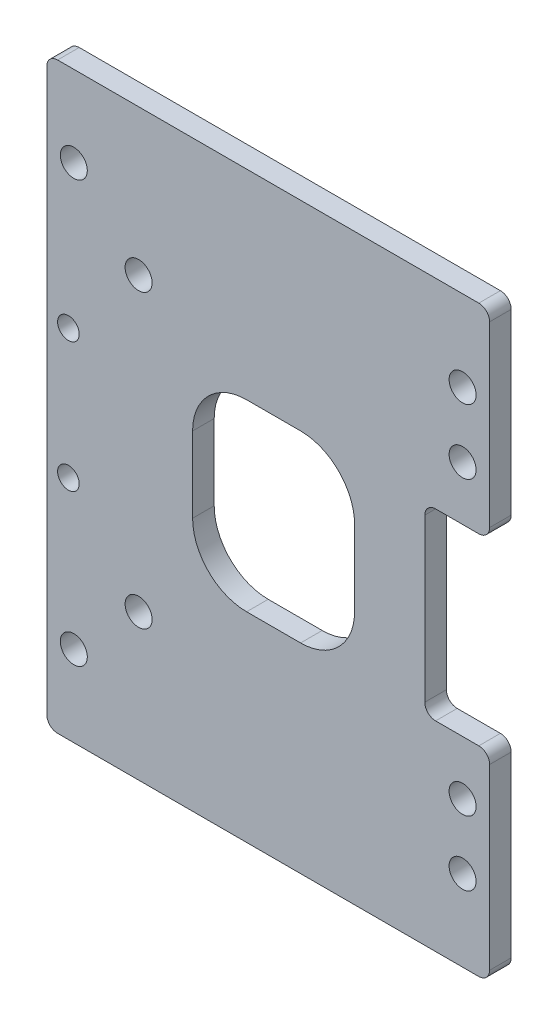
from build123d import *

# Parameters (mm, degrees)
SKETCH_1_R      = 1.25
SKETCH_1_R_2    = 1
EXTRUDE_1_DEPTH = 2


with BuildPart() as part:
    # 草圖1 → 填料-伸長1 (new body)
    with BuildSketch(Plane.XY):
        with BuildLine():
            Line((25.714690816, 4.04468624), (25.714690816, -0.95531376))
            Line((25.714690816, -0.95531376), (25.714690816, -12.45531376))
            ThreePointArc((25.714690816, -12.45531376), (25.421797597, -13.162420542), (24.714690816, -13.45531376))
            Line((24.714690816, -13.45531376), (-14.285309184, -13.45531376))
            ThreePointArc((-14.285309184, -13.45531376), (-14.992415965, -13.162420542), (-15.285309184, -12.45531376))
            Line((-15.285309184, -12.45531376), (-15.285309184, 3.54468624))
            Line((-15.285309184, 3.54468624), (-15.285309184, 23.54468624))
            Line((-15.285309184, 23.54468624), (-15.285309184, 39.54468624))
            ThreePointArc((-15.285309184, 39.54468624), (-14.992415965, 40.251793021), (-14.285309184, 40.54468624))
            Line((-14.285309184, 40.54468624), (24.714690816, 40.54468624))
            ThreePointArc((24.714690816, 40.54468624), (25.421797597, 40.251793021), (25.714690816, 39.54468624))
            Line((25.714690816, 39.54468624), (25.714690816, 28.54468624))
            Line((25.714690816, 28.54468624), (25.714690816, 23.04468624))
            ThreePointArc((25.714690816, 23.04468624), (25.421797597, 22.337579458), (24.714690816, 22.04468624))
            Line((24.714690816, 22.04468624), (20.714690816, 22.04468624))
            ThreePointArc((20.714690816, 22.04468624), (20.007584035, 21.751793021), (19.714690816, 21.04468624))
            Line((19.714690816, 21.04468624), (19.714690816, 6.04468624))
            ThreePointArc((19.714690816, 6.04468624), (20.007584035, 5.337579458), (20.714690816, 5.04468624))
            Line((20.714690816, 5.04468624), (24.714690816, 5.04468624))
            ThreePointArc((24.714690816, 5.04468624), (25.421797597, 4.751793021), (25.714690816, 4.04468624))
        make_face()
        with Locations((-6.785309184, 27.04468624)):
            Circle(SKETCH_1_R, mode=Mode.SUBTRACT)
        with Locations((23.214690816, 27.04468624)):
            Circle(SKETCH_1_R, mode=Mode.SUBTRACT)
        with Locations((-6.785309184, 0.04468624)):
            Circle(SKETCH_1_R, mode=Mode.SUBTRACT)
        with Locations((23.214690816, 0.04468624)):
            Circle(SKETCH_1_R, mode=Mode.SUBTRACT)
        with Locations((-12.785309184, 33.04468624)):
            Circle(SKETCH_1_R, mode=Mode.SUBTRACT)
        with Locations((23.214690816, 33.04468624)):
            Circle(SKETCH_1_R, mode=Mode.SUBTRACT)
        with Locations(Location((23.214690816, -5.95531376, 0), (0, 0, 180))):
            Circle(SKETCH_1_R, mode=Mode.SUBTRACT)
        with Locations(Location((-12.785309184, -5.95531376, 0), (0, 0, 180))):
            Circle(SKETCH_1_R, mode=Mode.SUBTRACT)
        with Locations((-13.285309184, 19.54468624)):
            Circle(SKETCH_1_R_2, mode=Mode.SUBTRACT)
        with Locations((-13.285309184, 7.54468624)):
            Circle(SKETCH_1_R_2, mode=Mode.SUBTRACT)
        with BuildLine():
            Line((3.214690816, 22.04468624), (8.214690816, 22.04468624))
            ThreePointArc((8.214690816, 22.04468624), (11.750224722, 20.580220146), (13.214690816, 17.04468624))
            Line((13.214690816, 17.04468624), (13.214690816, 10.04468624))
            ThreePointArc((13.214690816, 10.04468624), (11.750224722, 6.509152334), (8.214690816, 5.04468624))
            Line((8.214690816, 5.04468624), (3.214690816, 5.04468624))
            ThreePointArc((3.214690816, 5.04468624), (-0.32084309, 6.509152334), (-1.785309184, 10.04468624))
            Line((-1.785309184, 10.04468624), (-1.785309184, 17.04468624))
            ThreePointArc((-1.785309184, 17.04468624), (-0.32084309, 20.580220146), (3.214690816, 22.04468624))
        make_face(mode=Mode.SUBTRACT)
    extrude(amount=EXTRUDE_1_DEPTH)


solid = part.part
